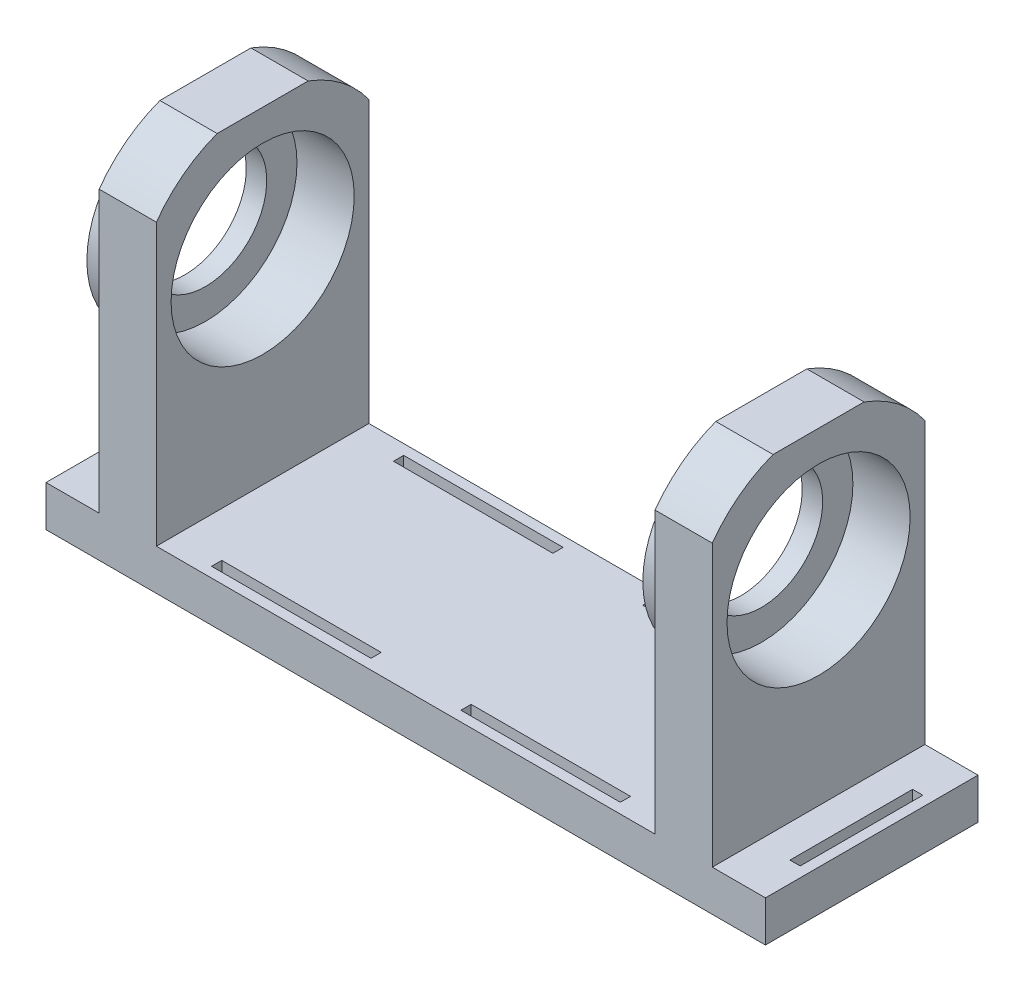
from build123d import *

# Parameters (mm, degrees)
SKETCH1_W            = 20
SKETCH1_H            = 26
SKETCH1_W_2          = 1.25
SKETCH1_H_2          = 15
BOSS_EXTRUDE5_DEPTH  = 5
SKETCH3_W            = 7
SKETCH3_H            = 26
BOSS_EXTRUDE6_DEPTH  = 40
CUT_EXTRUDE1_REACH   = 55.696
SKETCH5_R            = 11.2
SKETCH6_W            = 26
SKETCH6_H            = 5
BOSS_EXTRUDE8_DEPTH  = 24
CUT_EXTRUDE2_REACH   = 102.1
SKETCH7_W            = 19.5
SKETCH7_H            = 1.25
SKETCH8_R            = 12
SKETCH8_R_2          = 7.5
BOSS_EXTRUDE9_DEPTH  = 2.5
SKETCH9_R            = 12
SKETCH9_R_2          = 7.5
BOSS_EXTRUDE10_DEPTH = 2.5


with BuildPart() as part:
    # Sketch1 → Boss-Extrude5 (new body)
    with BuildSketch(Plane(origin=(0, 0, 0), x_dir=(1, 0, 0), z_dir=(0, 1, 0))):
        with Locations((10, 13)):
            Rectangle(SKETCH1_W, SKETCH1_H)
        with Locations((1.875, 13)):
            Rectangle(SKETCH1_W_2, SKETCH1_H_2, mode=Mode.SUBTRACT)
    boss_extrude5 = extrude(amount=BOSS_EXTRUDE5_DEPTH)

    # Sketch3 → Boss-Extrude6 (add)
    with BuildSketch(Plane(origin=(0, 5, 0), x_dir=(1, 0, 0), z_dir=(0, 1, 0))):
        with Locations((10, 13)):
            Rectangle(SKETCH3_W, SKETCH3_H)
    boss_extrude6 = extrude(amount=BOSS_EXTRUDE6_DEPTH)

    # Sketch5 → Cut-Extrude1 (cut, up to next)
    with BuildSketch(Plane(origin=(13.5, 0, 0), x_dir=(0, 0, -1), z_dir=(1, 0, 0)), mode=Mode.PRIVATE) as cut_extrude1_sk1:
        with Locations((13, 30)):
            Circle(SKETCH5_R)
    cut_extrude1_tool1 = extrude(cut_extrude1_sk1.sketch, amount=-CUT_EXTRUDE1_REACH, mode=Mode.PRIVATE) & part.part
    # Sketch5 → Cut-Extrude1 (cut, up to next)
    with BuildSketch(Plane(origin=(13.5, 0, 0), x_dir=(0, 0, -1), z_dir=(1, 0, 0)), mode=Mode.PRIVATE) as cut_extrude1_sk2:
        with BuildLine():
            Line((7.432235637, 45), (0, 45))
            Line((0, 45), (0, 39.327379053))
            ThreePointArc((0, 39.327379053), (3.292522189, 42.718682107), (7.432235637, 45))
        make_face()
    cut_extrude1_tool2 = extrude(cut_extrude1_sk2.sketch, amount=-CUT_EXTRUDE1_REACH, mode=Mode.PRIVATE) & part.part
    # Sketch5 → Cut-Extrude1 (cut, up to next)
    with BuildSketch(Plane(origin=(13.5, 0, 0), x_dir=(0, 0, -1), z_dir=(1, 0, 0)), mode=Mode.PRIVATE) as cut_extrude1_sk3:
        with BuildLine():
            Line((26, 39.327379053), (26, 45))
            Line((26, 45), (18.567764363, 45))
            ThreePointArc((18.567764363, 45), (22.707477811, 42.718682107), (26, 39.327379053))
        make_face()
    cut_extrude1_tool3 = extrude(cut_extrude1_sk3.sketch, amount=-CUT_EXTRUDE1_REACH, mode=Mode.PRIVATE) & part.part
    cut_extrude1_1 = cut_extrude1_tool1.solids().sort_by_distance((13.5, 30, -13))[0]
    add(cut_extrude1_1, mode=Mode.SUBTRACT)
    cut_extrude1_2 = cut_extrude1_tool2.solids().sort_by_distance((13.5, 43.298273, -2.197768))[0]
    add(cut_extrude1_2, mode=Mode.SUBTRACT)
    cut_extrude1_3 = cut_extrude1_tool3.solids().sort_by_distance((13.5, 43.298273, -23.802232))[0]
    add(cut_extrude1_3, mode=Mode.SUBTRACT)
    cut_extrude1 = cut_extrude1_1 + cut_extrude1_2 + cut_extrude1_3  # Cut-Extrude1 as one shape, for the pattern or mirror that repeats it

    # Sketch6 → Boss-Extrude8 (add)
    with BuildSketch(Plane(origin=(20, 0, 0), x_dir=(0, 0, -1), z_dir=(1, 0, 0))):
        with Locations((13, 2.5)):
            Rectangle(SKETCH6_W, SKETCH6_H)
    boss_extrude8 = extrude(amount=BOSS_EXTRUDE8_DEPTH)

    # Mirror5: Boss-Extrude5, Boss-Extrude6, Cut-Extrude1, Boss-Extrude8 across plane
    add(boss_extrude5.mirror(Plane.ZY.offset(-44)))
    add(boss_extrude6.mirror(Plane.ZY.offset(-44)))
    add(cut_extrude1.mirror(Plane.ZY.offset(-44)), mode=Mode.SUBTRACT)
    add(boss_extrude8.mirror(Plane.ZY.offset(-44)))

    # Sketch7 → Cut-Extrude2 (cut, up to next)
    with BuildSketch(Plane(origin=(0, 5, 0), x_dir=(1, 0, 0), z_dir=(0, 1, 0)), mode=Mode.PRIVATE) as cut_extrude2_sk1:
        with Locations((28.75, 1.875)):
            Rectangle(SKETCH7_W, SKETCH7_H)
    cut_extrude2_tool1 = extrude(cut_extrude2_sk1.sketch, amount=-CUT_EXTRUDE2_REACH, mode=Mode.PRIVATE) & part.part
    # Sketch7 → Cut-Extrude2 (cut, up to next)
    with BuildSketch(Plane(origin=(0, 5, 0), x_dir=(1, 0, 0), z_dir=(0, 1, 0)), mode=Mode.PRIVATE) as cut_extrude2_sk2:
        with Locations((59.25, 1.875)):
            Rectangle(SKETCH7_W, SKETCH7_H)
    cut_extrude2_tool2 = extrude(cut_extrude2_sk2.sketch, amount=-CUT_EXTRUDE2_REACH, mode=Mode.PRIVATE) & part.part
    # Sketch7 → Cut-Extrude2 (cut, up to next)
    with BuildSketch(Plane(origin=(0, 5, 0), x_dir=(1, 0, 0), z_dir=(0, 1, 0)), mode=Mode.PRIVATE) as cut_extrude2_sk3:
        with Locations((59.25, 24.125)):
            Rectangle(SKETCH7_W, SKETCH7_H)
    cut_extrude2_tool3 = extrude(cut_extrude2_sk3.sketch, amount=-CUT_EXTRUDE2_REACH, mode=Mode.PRIVATE) & part.part
    # Sketch7 → Cut-Extrude2 (cut, up to next)
    with BuildSketch(Plane(origin=(0, 5, 0), x_dir=(1, 0, 0), z_dir=(0, 1, 0)), mode=Mode.PRIVATE) as cut_extrude2_sk4:
        with Locations((28.75, 24.125)):
            Rectangle(SKETCH7_W, SKETCH7_H)
    cut_extrude2_tool4 = extrude(cut_extrude2_sk4.sketch, amount=-CUT_EXTRUDE2_REACH, mode=Mode.PRIVATE) & part.part
    add(cut_extrude2_tool1.solids().sort_by_distance((28.75, 5, -1.875))[0], mode=Mode.SUBTRACT)
    add(cut_extrude2_tool2.solids().sort_by_distance((59.25, 5, -1.875))[0], mode=Mode.SUBTRACT)
    add(cut_extrude2_tool3.solids().sort_by_distance((59.25, 5, -24.125))[0], mode=Mode.SUBTRACT)
    add(cut_extrude2_tool4.solids().sort_by_distance((28.75, 5, -24.125))[0], mode=Mode.SUBTRACT)

    # Sketch8 → Boss-Extrude9 (add)
    with BuildSketch(Plane.ZY.offset(-6.5)):
        with Locations(Location((-13, 30, 0), (0, 0, 180))):
            Circle(SKETCH8_R)
        with Locations((-13, 30)):
            Circle(SKETCH8_R_2, mode=Mode.SUBTRACT)
    extrude(amount=BOSS_EXTRUDE9_DEPTH)

    # Sketch9 → Boss-Extrude10 (add)
    with BuildSketch(Plane.ZY.offset(-74.5)):
        with Locations(Location((-13, 30, 0), (0, 0, 180))):
            Circle(SKETCH9_R)
        with Locations((-13, 30)):
            Circle(SKETCH9_R_2, mode=Mode.SUBTRACT)
    extrude(amount=BOSS_EXTRUDE10_DEPTH)


solid = part.part
